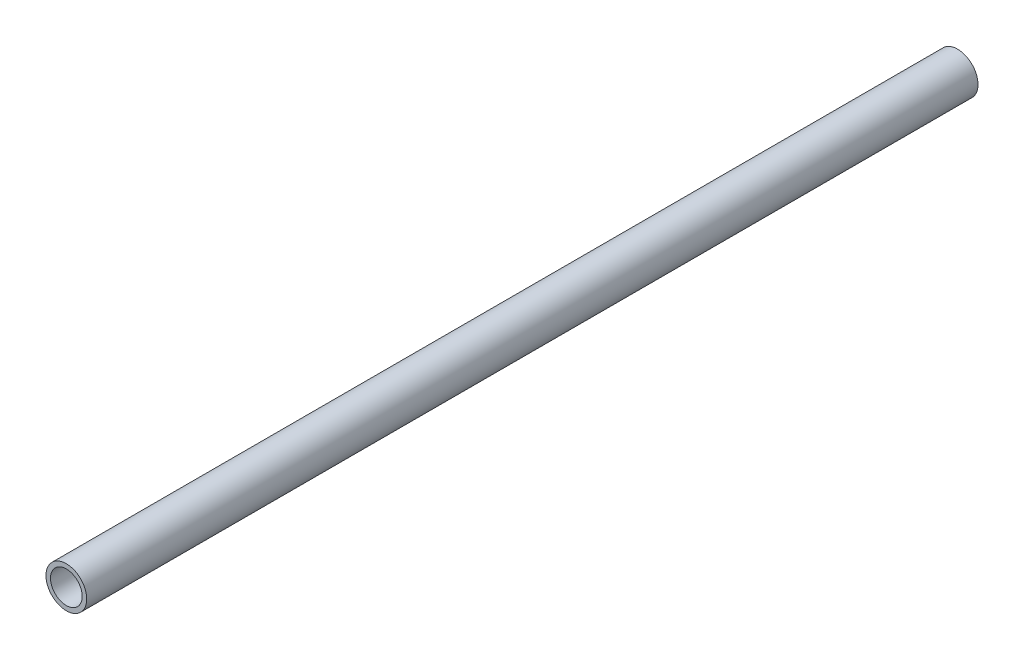
from build123d import *

# Parameters (mm, degrees)
SKETCH1_R           = 9
SKETCH1_R_2         = 7
BOSS_EXTRUDE1_DEPTH = 393.37


with BuildPart() as part:
    # Sketch1 → Boss-Extrude1 (new body)
    with BuildSketch(Plane.XY):
        Circle(SKETCH1_R)
        Circle(SKETCH1_R_2, mode=Mode.SUBTRACT)
    extrude(amount=BOSS_EXTRUDE1_DEPTH)


solid = part.part
